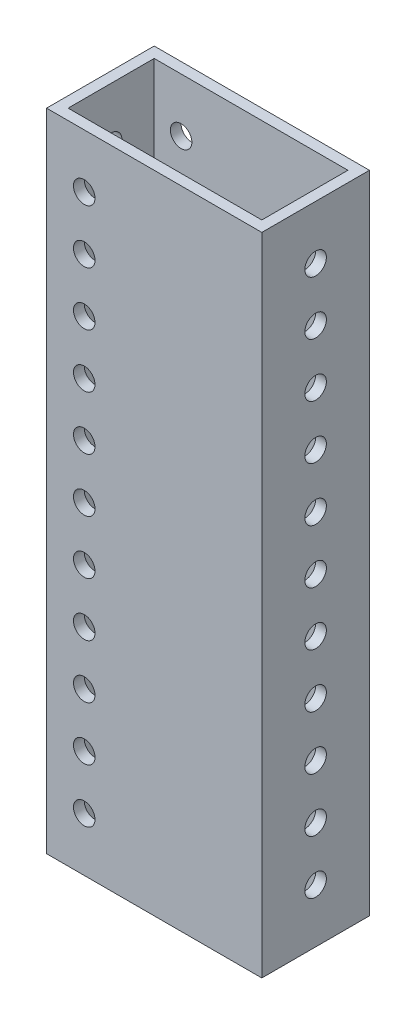
from build123d import *

# Parameters (mm, degrees)
SKETCH1_W           = 50.8
SKETCH1_H           = 25.4
SKETCH1_W_2         = 45.72
SKETCH1_H_2         = 20.32
BOSS_EXTRUDE2_DEPTH = 152.4
SKETCH2_R           = 2.54
CUT_EXTRUDE1_DEPTH  = 127
SKETCH3_R           = 2.54
CUT_EXTRUDE2_DEPTH  = 166.725706651


with BuildPart() as part:
    # Sketch1 → Boss-Extrude2 (new body)
    with BuildSketch(Plane(origin=(0, 0, 0), x_dir=(1, 0, 0), z_dir=(0, 1, 0))):
        with Locations((-34.550728477, 5.021125828)):
            Rectangle(SKETCH1_W, SKETCH1_H)
        with Locations((-34.550728477, 5.021125828)):
            Rectangle(SKETCH1_W_2, SKETCH1_H_2, mode=Mode.SUBTRACT)
    extrude(amount=BOSS_EXTRUDE2_DEPTH)

    # Sketch2 → Cut-Extrude1 (cut)
    with BuildSketch(Plane(origin=(-9.150728477, 0, 0), x_dir=(0, 0, -1), z_dir=(1, 0, 0))):
        with Locations((5.021125828, 139.7)):
            Circle(SKETCH2_R)
        with Locations((5.021125828, 127)):
            Circle(SKETCH2_R)
        with Locations((5.021125828, 114.3)):
            Circle(SKETCH2_R)
        with Locations((5.021125828, 101.6)):
            Circle(SKETCH2_R)
        with Locations((5.021125828, 88.9)):
            Circle(SKETCH2_R)
        with Locations((5.021125828, 76.2)):
            Circle(SKETCH2_R)
        with Locations((5.021125828, 63.5)):
            Circle(SKETCH2_R)
        with Locations((5.021125828, 50.8)):
            Circle(SKETCH2_R)
        with Locations((5.021125828, 38.1)):
            Circle(SKETCH2_R)
        with Locations((5.021125828, 25.4)):
            Circle(SKETCH2_R)
        with Locations((5.021125828, 12.7)):
            Circle(SKETCH2_R)
    extrude(amount=-CUT_EXTRUDE1_DEPTH, mode=Mode.SUBTRACT)

    # Sketch3 → Cut-Extrude2 (cut, through all)
    with BuildSketch(Plane(origin=(0, 0, -17.721125828), x_dir=(-1, 0, 0), z_dir=(0, 0, -1))):
        with Locations((51.060728477, 139.7)):
            Circle(SKETCH3_R)
        with Locations((51.060728477, 127)):
            Circle(SKETCH3_R)
        with Locations((51.060728477, 114.3)):
            Circle(SKETCH3_R)
        with Locations((51.060728477, 101.6)):
            Circle(SKETCH3_R)
        with Locations((51.060728477, 88.9)):
            Circle(SKETCH3_R)
        with Locations((51.060728477, 76.2)):
            Circle(SKETCH3_R)
        with Locations((51.060728477, 63.5)):
            Circle(SKETCH3_R)
        with Locations((51.060728477, 50.8)):
            Circle(SKETCH3_R)
        with Locations((51.060728477, 38.1)):
            Circle(SKETCH3_R)
        with Locations((51.060728477, 25.4)):
            Circle(SKETCH3_R)
        with Locations((51.060728477, 12.7)):
            Circle(SKETCH3_R)
    extrude(amount=-CUT_EXTRUDE2_DEPTH, mode=Mode.SUBTRACT)


solid = part.part
